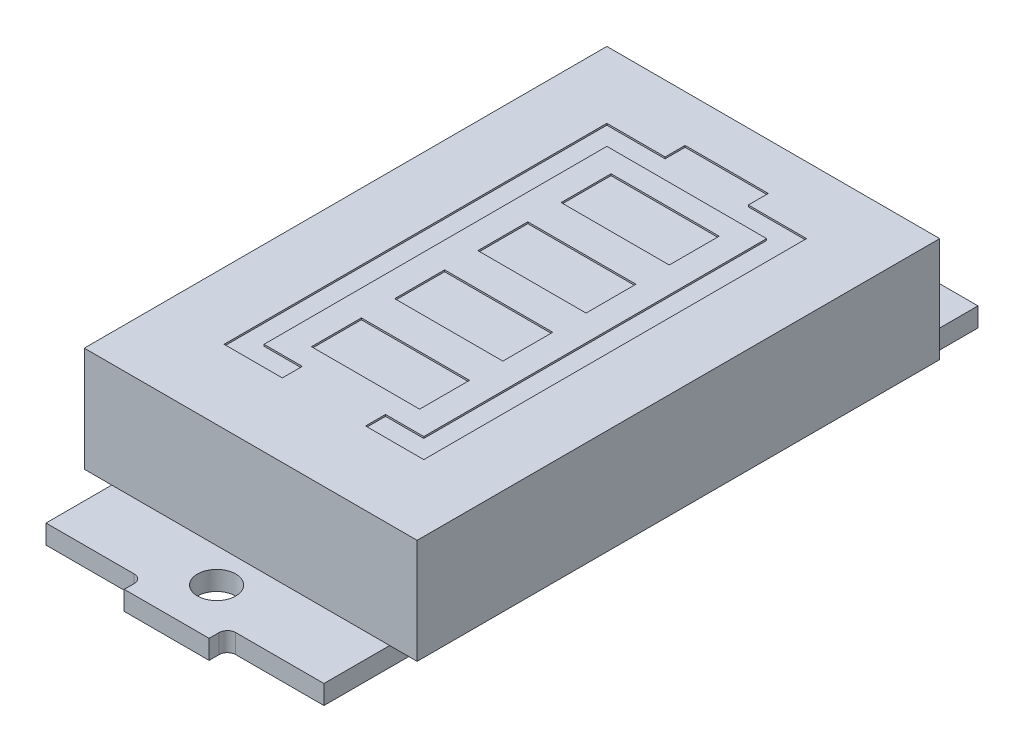
from build123d import *

# Parameters (mm, degrees)
ESQUISSE1_R             = 1.15
BOSS_EXTRU_1_DEPTH      = 1.15
CONG_1_R                = 0.5
ESQUISSE2_W             = 20
ESQUISSE2_H             = 31.4
BOSS_EXTRU_2_DEPTH      = 6.3
ESQUISSE4_W             = 6.5
ESQUISSE4_H             = 3
ENL_V_MAT_EXTRU_1_DEPTH = 0.1


with BuildPart() as part:
    # Esquisse1 → Boss.-Extru.1 (new body)
    with BuildSketch(Plane(origin=(0, 0, 0), x_dir=(1, 0, 0), z_dir=(0, 1, 0))):
        Polygon((-2.55, -19.65), (-2.55, -20.75), (2.55, -20.75), (2.55, -19.65), (8.35, -19.65), (8.35, 19.65), (2.55, 19.65), (2.55, 20.75), (-2.55, 20.75), (-2.55, 19.65), (-8.35, 19.65), (-8.35, -19.65), align=None)
        with Locations(Location((0, -17.75, 0), (0, 0, 270))):
            Circle(ESQUISSE1_R, mode=Mode.SUBTRACT)
        with Locations(Location((0, 17.75, 0), (0, 0, 270))):
            Circle(ESQUISSE1_R, mode=Mode.SUBTRACT)
    extrude(amount=BOSS_EXTRU_1_DEPTH)

    # Congé1
    cong_1_edges = [part.edges().sort_by_distance(p)[0] for p in [
        (-2.55, 0.575, 19.65),
        (-2.55, 0.575, -19.65),
        (2.55, 0.575, -19.65),
        (2.55, 0.575, 19.65),
    ]]
    fillet(cong_1_edges, radius=CONG_1_R)

    # Esquisse2 → Boss.-Extru.2 (add)
    with BuildSketch(Plane(origin=(0, 1.15, 0), x_dir=(1, 0, 0), z_dir=(0, 1, 0))):
        Rectangle(ESQUISSE2_W, ESQUISSE2_H)
    extrude(amount=BOSS_EXTRU_2_DEPTH)

    # Esquisse4 → Enlèv. mat.-Extru.1 (cut)
    with BuildSketch(Plane(origin=(0, 7.45, 0), x_dir=(1, 0, 0), z_dir=(0, 1, 0))):
        Polygon((0, 12.9), (0, 10.5), (4.8, 10.5), (4.8, -10.1), (2.5, -10.1), (2.5, -11.3), (6, -11.3), (6, 11.7), (2.5, 11.7), (2.5, 12.9), align=None)
        Polygon((-2.5, -11.3), (-2.5, -10.1), (-4.8, -10.1), (-4.8, 10.5), (0, 10.5), (0, 12.9), (-2.5, 12.9), (-2.5, 11.7), (-6, 11.7), (-6, -11.3), align=None)
        with Locations((0, 7.7)):
            Rectangle(ESQUISSE4_W, ESQUISSE4_H)
        with Locations((0, -2.3)):
            Rectangle(ESQUISSE4_W, ESQUISSE4_H)
        with Locations((0, -7.3)):
            Rectangle(ESQUISSE4_W, ESQUISSE4_H)
        with Locations((0, 2.7)):
            Rectangle(ESQUISSE4_W, ESQUISSE4_H)
    extrude(amount=-ENL_V_MAT_EXTRU_1_DEPTH, mode=Mode.SUBTRACT)


solid = part.part
